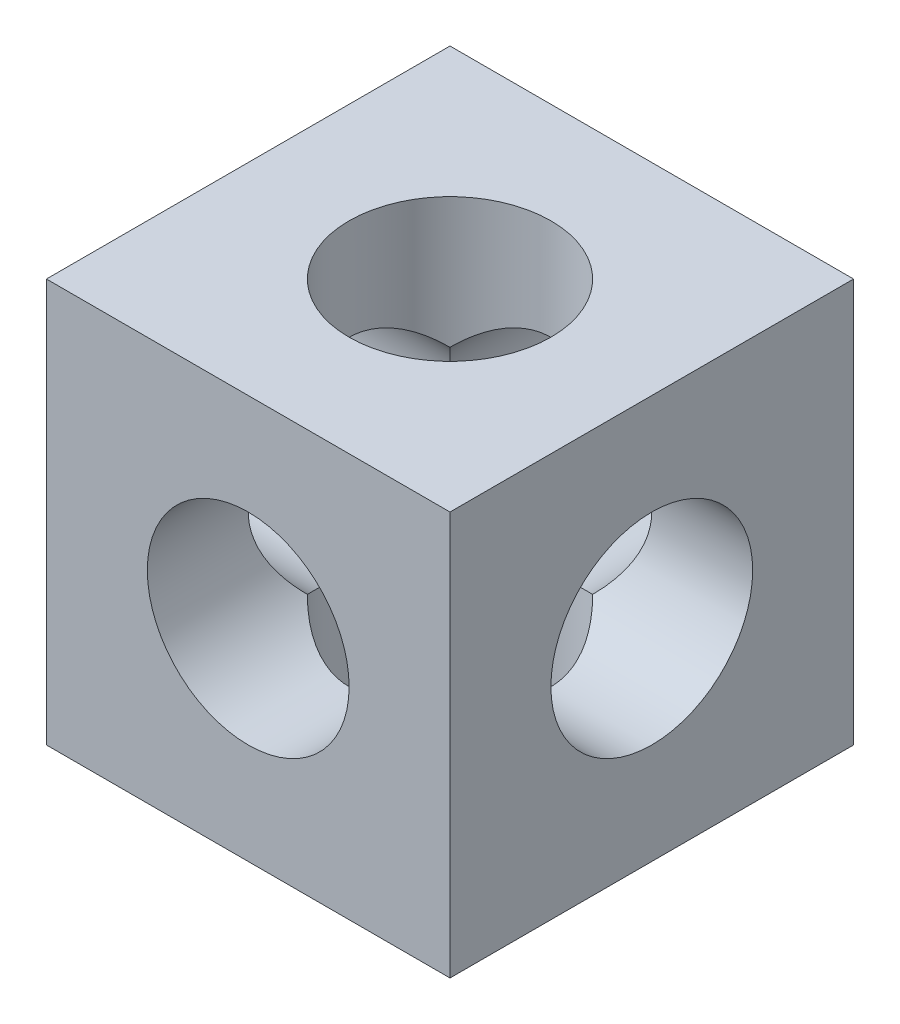
from build123d import *

# Parameters (mm, degrees)
SKETCH1_W           = 50.8
SKETCH1_H           = 50.8
BOSS_EXTRUDE1_DEPTH = 25.4
SKETCH2_R           = 12.7
CUT_EXTRUDE1_DEPTH  = 63.217039467
SKETCH3_R           = 12.7
CUT_EXTRUDE2_DEPTH  = 63.217039467
SKETCH4_R           = 12.7
CUT_EXTRUDE3_DEPTH  = 63.217039467


with BuildPart() as part:
    # Sketch1 → Boss-Extrude1 (new, symmetric)
    with BuildSketch(Plane(origin=(0, 0, 0), x_dir=(1, 0, 0), z_dir=(0, 1, 0))):
        Rectangle(SKETCH1_W, SKETCH1_H)
    extrude(amount=BOSS_EXTRUDE1_DEPTH, both=True)

    # Sketch2 → Cut-Extrude1 (cut, through all)
    with BuildSketch(Plane.XY.offset(25.4)):
        Circle(SKETCH2_R)
    extrude(amount=-CUT_EXTRUDE1_DEPTH, mode=Mode.SUBTRACT)

    # Sketch3 → Cut-Extrude2 (cut, through all)
    with BuildSketch(Plane(origin=(25.4, 0, 0), x_dir=(0, 0, -1), z_dir=(1, 0, 0))):
        Circle(SKETCH3_R)
    extrude(amount=-CUT_EXTRUDE2_DEPTH, mode=Mode.SUBTRACT)

    # Sketch4 → Cut-Extrude3 (cut, through all)
    with BuildSketch(Plane(origin=(0, 25.4, 0), x_dir=(1, 0, 0), z_dir=(0, 1, 0))):
        with Locations(Location((0, 0, 0), (0, 0, 270))):
            Circle(SKETCH4_R)
    extrude(amount=-CUT_EXTRUDE3_DEPTH, mode=Mode.SUBTRACT)


solid = part.part
